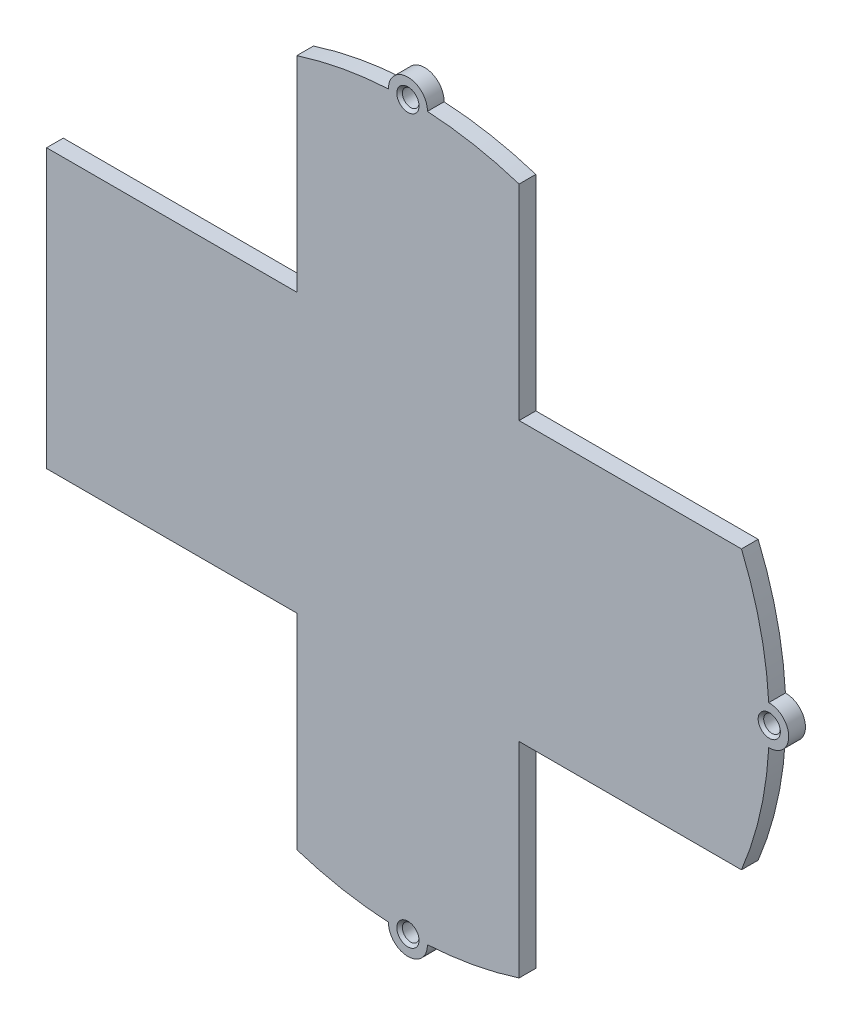
from build123d import *

# Parameters (mm, degrees)
EXTRUDE_1_DEPTH     = 3
SKETCH_2_R          = 3.5
EXTRUDE_2_DEPTH     = 3
SKETCH_3_R          = 1.5
CUT_EXTRUDE_1_DEPTH = 3
CHAMFER_1_SIZE      = 0.5
EXTRUDE_START       = -3
EXTRUDE_4_DEPTH     = 3


with BuildPart() as part:
    # 草图1 → 凸台-拉伸1 (new body)
    with BuildSketch(Plane.XY):
        with BuildLine():
            Line((20, -25), (20, -61.846584384))
            ThreePointArc((20, -61.846584384), (0, -65), (-20, -61.846584384))
            Line((-20, -61.846584384), (-20, -25))
            Line((-20, -25), (-60, -25))
            ThreePointArc((-60, -25), (-65, 0), (-60, 25))
            Line((-60, 25), (-20, 25))
            Line((-20, 25), (-20, 61.846584384))
            ThreePointArc((-20, 61.846584384), (0, 65), (20, 61.846584384))
            Line((20, 61.846584384), (20, 25))
            Line((20, 25), (60, 25))
            ThreePointArc((60, 25), (65, 0), (60, -25))
            Line((60, -25), (20, -25))
        make_face()
    extrude(amount=EXTRUDE_1_DEPTH)

    # 草图2 → 凸台-拉伸2 (add)
    with BuildSketch(Plane.XY.offset(3)):
        with Locations((65, 0)):
            Circle(SKETCH_2_R)
        with Locations((0, 65)):
            Circle(SKETCH_2_R)
        with Locations((0, -65)):
            Circle(SKETCH_2_R)
    extrude(amount=-EXTRUDE_2_DEPTH)

    # 草图3 → 切除-拉伸1 (cut)
    with BuildSketch(Plane.XY.offset(3)):
        with Locations((0, 65)):
            Circle(SKETCH_3_R)
        with Locations((65, 0)):
            Circle(SKETCH_3_R)
        with Locations((0, -65)):
            Circle(SKETCH_3_R)
    extrude(amount=-CUT_EXTRUDE_1_DEPTH, mode=Mode.SUBTRACT)

    # 倒角1
    chamfer_1_edges = [part.edges().sort_by_distance(p)[0] for p in [
        (-1.5, 65, 3),
        (63.5, 0, 3),
        (-1.5, -65, 3),
    ]]
    chamfer(chamfer_1_edges, length=CHAMFER_1_SIZE)

    # 草图4 → 凸台-拉伸4 (add)
    with BuildSketch(Plane.XY.offset(3).offset(EXTRUDE_START)):
        with BuildLine():
            ThreePointArc((-60, -25), (-63.73774392, -12.747548784), (-65, 0))
            Line((-65, 0), (-65, -25))
            Line((-65, -25), (-60, -25))
        make_face()
        with BuildLine():
            ThreePointArc((-65, 0), (-63.73774392, 12.747548784), (-60, 25))
            Line((-60, 25), (-65, 25))
            Line((-65, 25), (-65, 0))
        make_face()
    extrude(amount=EXTRUDE_4_DEPTH)


solid = part.part
